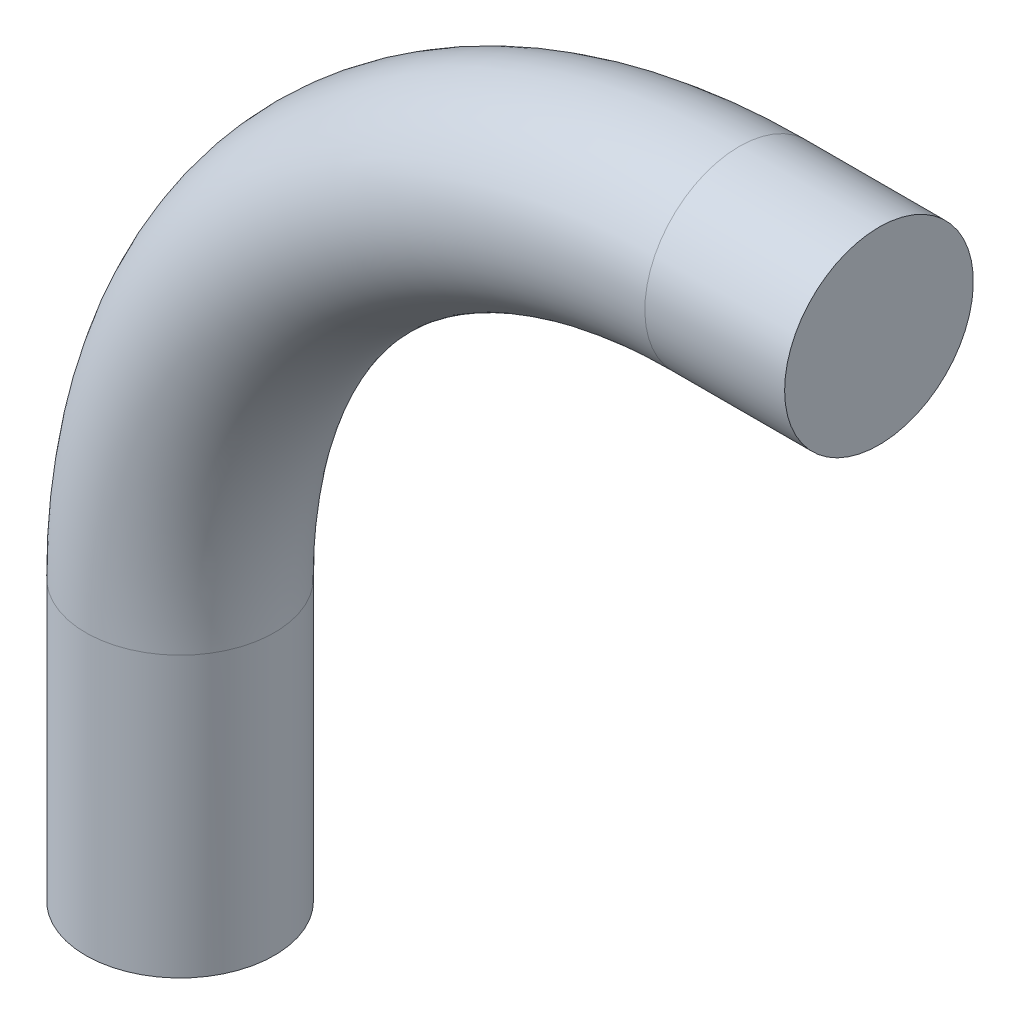
from build123d import *

# Parameters (mm, degrees)
SKETCH2_R = 6.75


with BuildPart() as part:
    # Sweep1: sweep along a path in Sketch1
    with BuildLine(Plane.XY) as sweep1_path:
        Line((0, 0), (0, 20))
        ThreePointArc((0, 20), (11.715728753, 48.284271247), (40, 60))
        Line((40, 60), (50, 60))
    # Sketch2 → Sweep1 (sweep)
    with BuildSketch(Plane(origin=(0, 0, 0), x_dir=(1, 0, 0), z_dir=(0, 1, 0))):
        Circle(SKETCH2_R)
    sweep(path=sweep1_path.line)


solid = part.part
